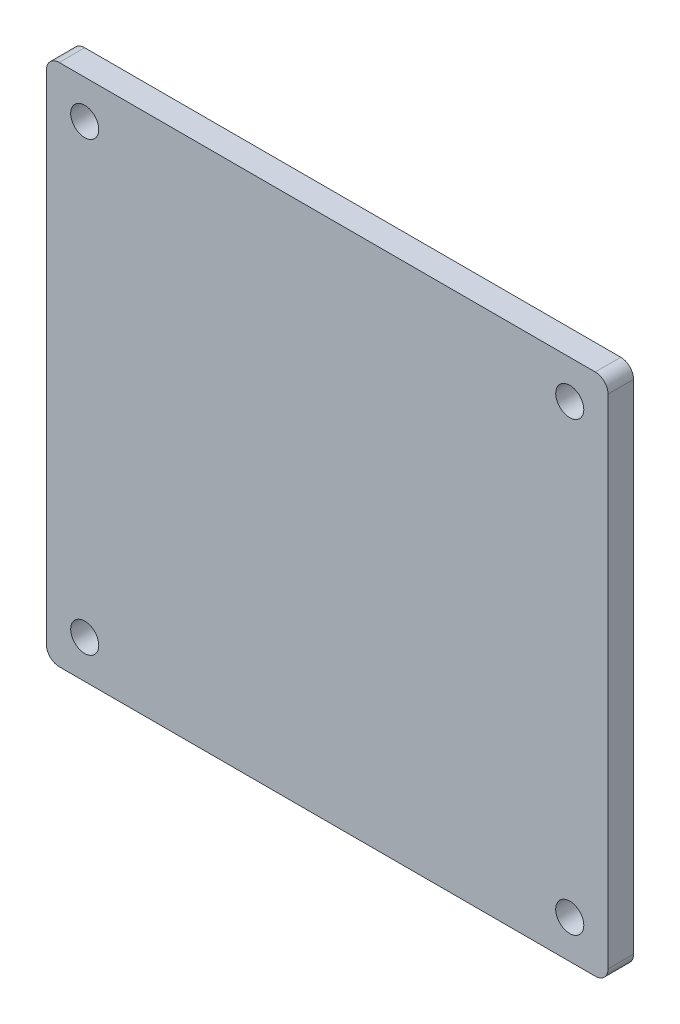
from build123d import *

# Parameters (mm, degrees)
SKETCH_1_W          = 44
SKETCH_1_H          = 41
EXTRUDE_1_DEPTH     = 2
SKETCH_2_R          = 1.1
CUT_EXTRUDE_1_DEPTH = 2
FILLET_1_R          = 1


with BuildPart() as part:
    # 草图1 → 凸台-拉伸1 (new body)
    with BuildSketch(Plane.XY):
        Rectangle(SKETCH_1_W, SKETCH_1_H)
    extrude(amount=EXTRUDE_1_DEPTH)

    # 草图2 → 切除-拉伸1 (cut)
    with BuildSketch(Plane.XY.offset(2)):
        with Locations((19, 17.5)):
            Circle(SKETCH_2_R)
        with Locations((-19, 17.5)):
            Circle(SKETCH_2_R)
        with Locations((-19, -17.5)):
            Circle(SKETCH_2_R)
        with Locations((19, -17.5)):
            Circle(SKETCH_2_R)
    extrude(amount=-CUT_EXTRUDE_1_DEPTH, mode=Mode.SUBTRACT)

    # 圆角1
    fillet_1_edges = [part.edges().sort_by_distance(p)[0] for p in [
        (22, -20.5, 1),
        (-22, -20.5, 1),
        (-22, 20.5, 1),
        (22, 20.5, 1),
    ]]
    fillet(fillet_1_edges, radius=FILLET_1_R)


solid = part.part
